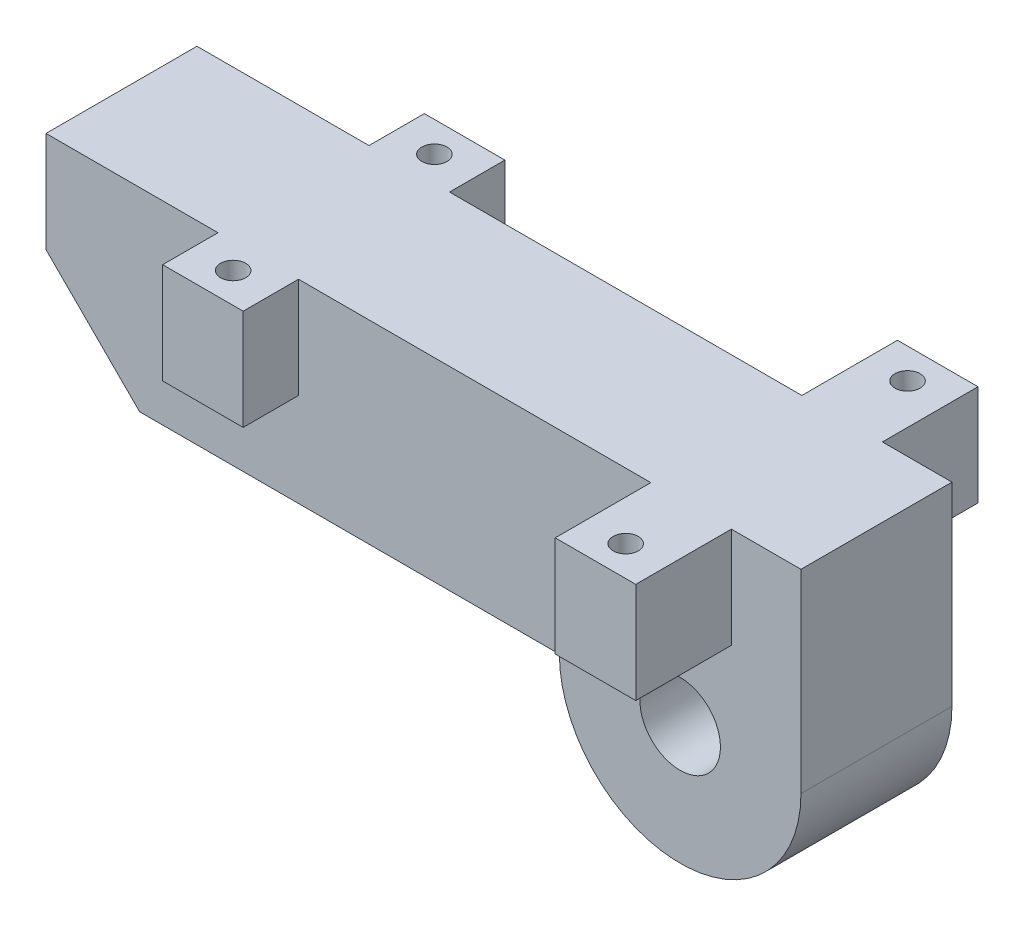
from build123d import *

# Parameters (mm, degrees)
EXTRUDE_1_DEPTH    = 10
HOLE_WIZARD_M3_1_D = 2.5
SKETCH_6_R         = 4
EXTRUDE_2_DEPTH    = 15


with BuildPart() as part:
    # 草图2 → 凸台-拉伸1 (new body)
    with BuildSketch(Plane(origin=(0, 0, 0), x_dir=(1, 0, 0), z_dir=(0, 1, 0))):
        Polygon((37.5, 7.5), (30.587879709, 7.5), (30.587879709, 17), (22.587879709, 17), (22.587879709, 7.5), (-12.412120291, 7.5), (-12.412120291, 13), (-20.412120291, 13), (-20.412120291, 7.5), (-37.5, 7.5), (-37.5, -7.5), (-20.412120291, -7.5), (-20.412120291, -13), (-12.412120291, -13), (-12.412120291, -7.5), (22.587879709, -7.5), (22.587879709, -17), (30.587879709, -17), (30.587879709, -7.5), (37.5, -7.5), align=None)
    extrude(amount=EXTRUDE_1_DEPTH)

    # M3 螺纹孔1 (through all)
    with Locations(Plane(origin=(0, 10, 0), x_dir=(1, 0, 0), z_dir=(0, 1, 0))):
        with Locations((-16.412120291, 10), (-16.412120291, -10), (26.587879709, 14), (26.587879709, -14)):
            Hole(HOLE_WIZARD_M3_1_D / 2)

    # 草图6 → 凸台-拉伸2 (add)
    with BuildSketch(Plane.XY.offset(7.5)):
        with BuildLine():
            Line((-37.5, 0), (37.5, 0))
            Line((37.5, 0), (37.5, -9.298476379))
            ThreePointArc((37.5, -9.298476379), (25.5, -21.298476379), (13.5, -9.298476379))
            Line((13.5, -9.298476379), (-28.201523621, -9.298476379))
            Line((-28.201523621, -9.298476379), (-37.5, 0))
        make_face()
        with Locations((25.5, -9.298476379)):
            Circle(SKETCH_6_R, mode=Mode.SUBTRACT)
    extrude(amount=-EXTRUDE_2_DEPTH)


solid = part.part
